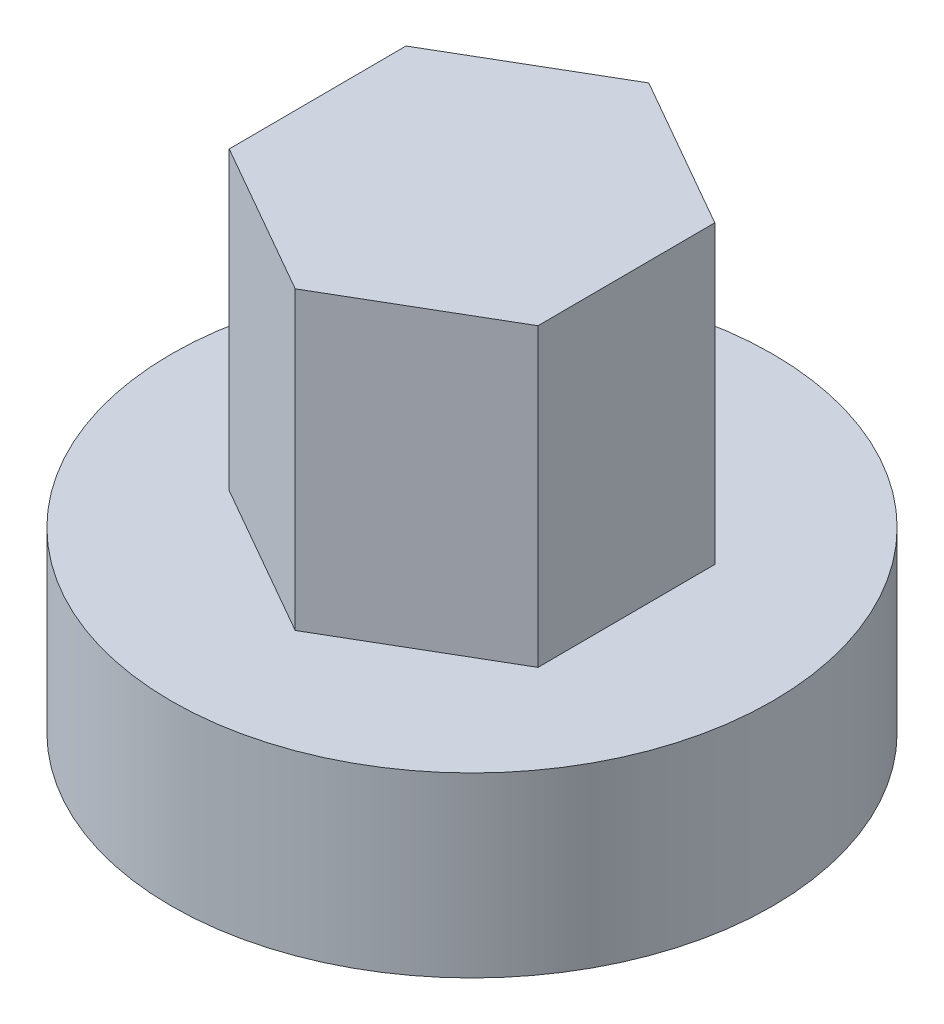
from build123d import *

# Parameters (mm, degrees)
SKETCH1_R           = 25.4
BOSS_EXTRUDE1_DEPTH = 15
BOSS_EXTRUDE2_DEPTH = 25


with BuildPart() as part:
    # Sketch1 → Boss-Extrude1 (new body)
    with BuildSketch(Plane(origin=(0, 0, 0), x_dir=(1, 0, 0), z_dir=(0, 1, 0))):
        Circle(SKETCH1_R)
    extrude(amount=-BOSS_EXTRUDE1_DEPTH)

    # Sketch1<3> → Boss-Extrude2 (add)
    with BuildSketch(Plane(origin=(0, 0, 0), x_dir=(1, 0, 0), z_dir=(0, 1, 0))):
        Polygon((12.958072873, 7.555683121), (-0.064377089, 14.999861852), (-13.022449962, 7.444178731), (-12.958072873, -7.555683121), (0.064377089, -14.999861852), (13.022449962, -7.444178731), align=None)
    extrude(amount=BOSS_EXTRUDE2_DEPTH)


solid = part.part
